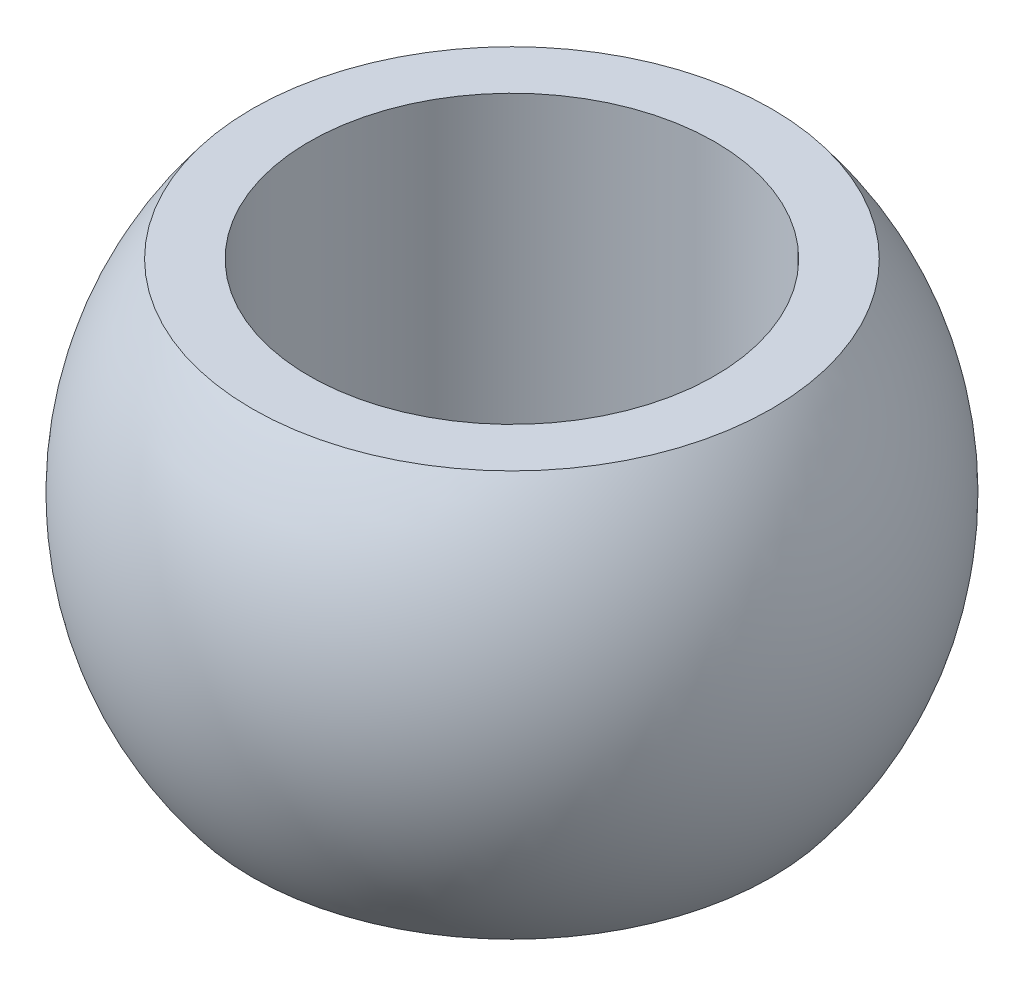
from build123d import *


with BuildPart() as part:
    # Sketch1 → Revolve1 (revolve)
    with BuildSketch(Plane.XY):
        with BuildLine():
            Line((-4, 4), (-4, -4))
            Line((-4, -4), (-5.123475383, -4))
            ThreePointArc((-5.123475383, -4), (-6.5, 0), (-5.123475383, 4))
            Line((-5.123475383, 4), (-4, 4))
        make_face()
    revolve(axis=Axis((0, -18.217687604, 0), (0, 1, 0)))


solid = part.part
